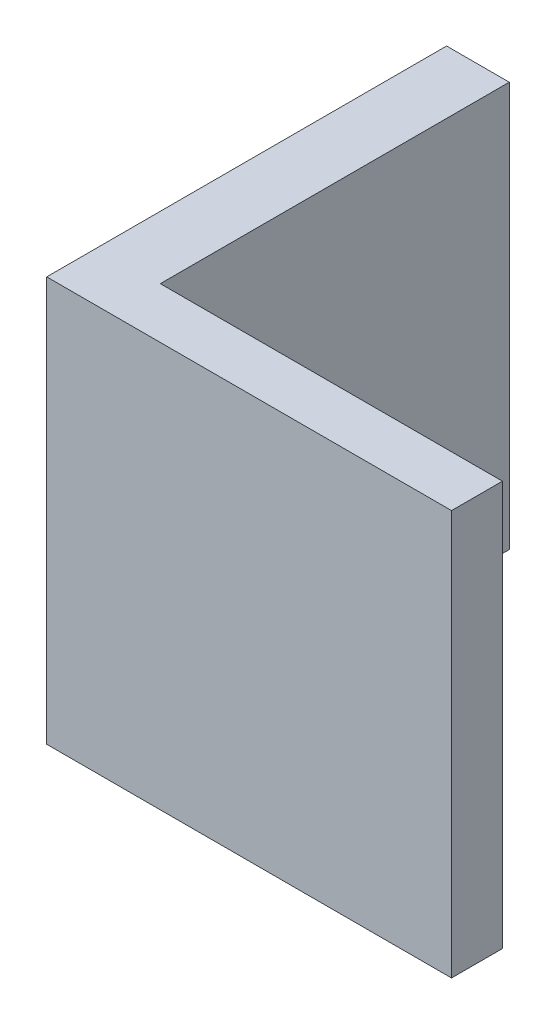
from build123d import *

# Parameters (mm, degrees)
SKETCH1_W           = 10.15978406
SKETCH1_H           = 10.035884255
BOSS_EXTRUDE1_DEPTH = 10.16
SKETCH2_W           = 8.586382864
SKETCH2_H           = 8.758227578
CUT_EXTRUDE1_DEPTH  = 10.16


with BuildPart() as part:
    # Sketch1 → Boss-Extrude1 (new body)
    with BuildSketch(Plane(origin=(0, 0, 0), x_dir=(1, 0, 0), z_dir=(0, 1, 0))):
        with Locations((-70.065340074, 22.240015107)):
            Rectangle(SKETCH1_W, SKETCH1_H)
    extrude(amount=BOSS_EXTRUDE1_DEPTH)

    # Sketch2 → Cut-Extrude1 (cut)
    with BuildSketch(Plane(origin=(0, 10.16, 0), x_dir=(1, 0, 0), z_dir=(0, 1, 0))):
        with Locations((-69.278639476, 22.878843446)):
            Rectangle(SKETCH2_W, SKETCH2_H)
    extrude(amount=-CUT_EXTRUDE1_DEPTH, mode=Mode.SUBTRACT)


solid = part.part
